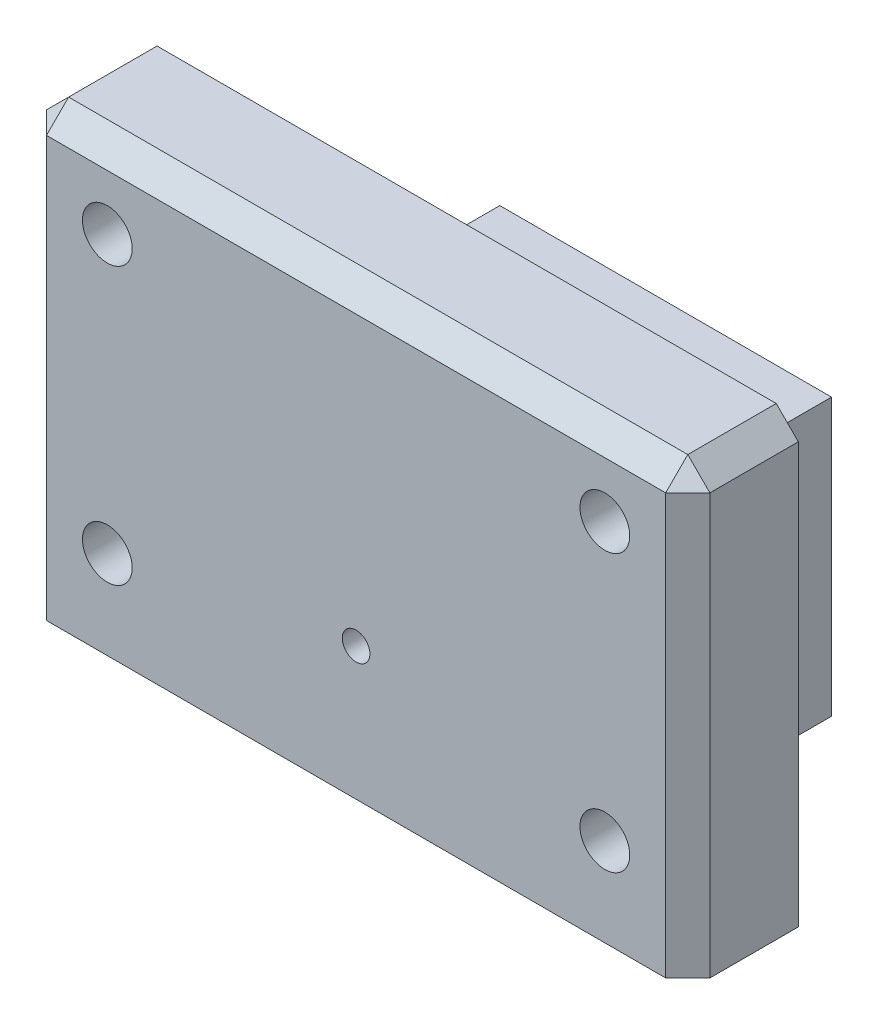
from build123d import *

# Parameters (mm, degrees)
SKETCH1_R               = 4
BOSS_EXTRUDE1_DEPTH     = 12.5
SKETCH2_W               = 60
SKETCH2_H               = 10
BOSS_EXTRUDE2_DEPTH     = 15
CHAMFER1_SIZE           = 2
SKETCH3_R               = 2.25
CUT_EXTRUDE1_DEPTH      = 45.5
CUT_EXTRUDE2_REACH      = 51.399
CUT_EXTRUDE2_END_RADIUS = 4
SKETCH4_R               = 1.25


with BuildPart() as part:
    # Sketch1 → Boss-Extrude1 (new, symmetric)
    with BuildSketch(Plane(origin=(0, 0, 0), x_dir=(1, 0, 0), z_dir=(0, 1, 0))):
        Polygon((-15, -9), (-30, -9), (-30, -19), (30, -19), (30, -9), (15, -9), (15, 9), (-15, 9), align=None)
        with Locations(Location((0, 0, 0), (0, 0, 270))):
            Circle(SKETCH1_R, mode=Mode.SUBTRACT)
    extrude(amount=BOSS_EXTRUDE1_DEPTH, both=True)

    # Sketch2 → Boss-Extrude2 (add)
    with BuildSketch(Plane(origin=(0, 12.5, 0), x_dir=(1, 0, 0), z_dir=(0, 1, 0))):
        with Locations((0, -14)):
            Rectangle(SKETCH2_W, SKETCH2_H)
    extrude(amount=BOSS_EXTRUDE2_DEPTH)

    # Chamfer1
    chamfer1_edges = [part.edges().sort_by_distance(p)[0] for p in [
        (30, 7.5, 19),
        (-30, 7.5, 19),
        (-30, 27.5, 14),
        (0, 27.5, 19),
        (30, 27.5, 14),
    ]]
    chamfer(chamfer1_edges, length=CHAMFER1_SIZE)

    # Sketch3 → Cut-Extrude1 (cut, through all)
    with BuildSketch(Plane(origin=(0, 0, 9), x_dir=(-1, 0, 0), z_dir=(0, 0, -1))):
        with Locations((-22.5, 20.5)):
            Circle(SKETCH3_R)
        with Locations((-22.5, -4.5)):
            Circle(SKETCH3_R)
        with Locations((22.5, 20.5)):
            Circle(SKETCH3_R)
        with Locations((22.5, -4.5)):
            Circle(SKETCH3_R)
    extrude(amount=-CUT_EXTRUDE1_DEPTH, mode=Mode.SUBTRACT)

    # Cut-Extrude2: up to this cylinder (the profile starts outside it)
    cut_extrude2_end = Plane(origin=(0, -0.5, 0), z_dir=(0, -1, 0)) * Cylinder(CUT_EXTRUDE2_END_RADIUS, 111.798, mode=Mode.PRIVATE)
    # Sketch4 → Cut-Extrude2 (cut, up to the surface)
    with BuildSketch(Plane.XY.offset(19), mode=Mode.PRIVATE) as cut_extrude2_sk1:
        with Locations((0, -0.5)):
            Circle(SKETCH4_R)
    cut_extrude2_tool1 = extrude(cut_extrude2_sk1.sketch, amount=-CUT_EXTRUDE2_REACH, mode=Mode.PRIVATE) - cut_extrude2_end
    add(cut_extrude2_tool1.solids().sort_by_distance((0, -0.5, 19))[0], mode=Mode.SUBTRACT)


solid = part.part
